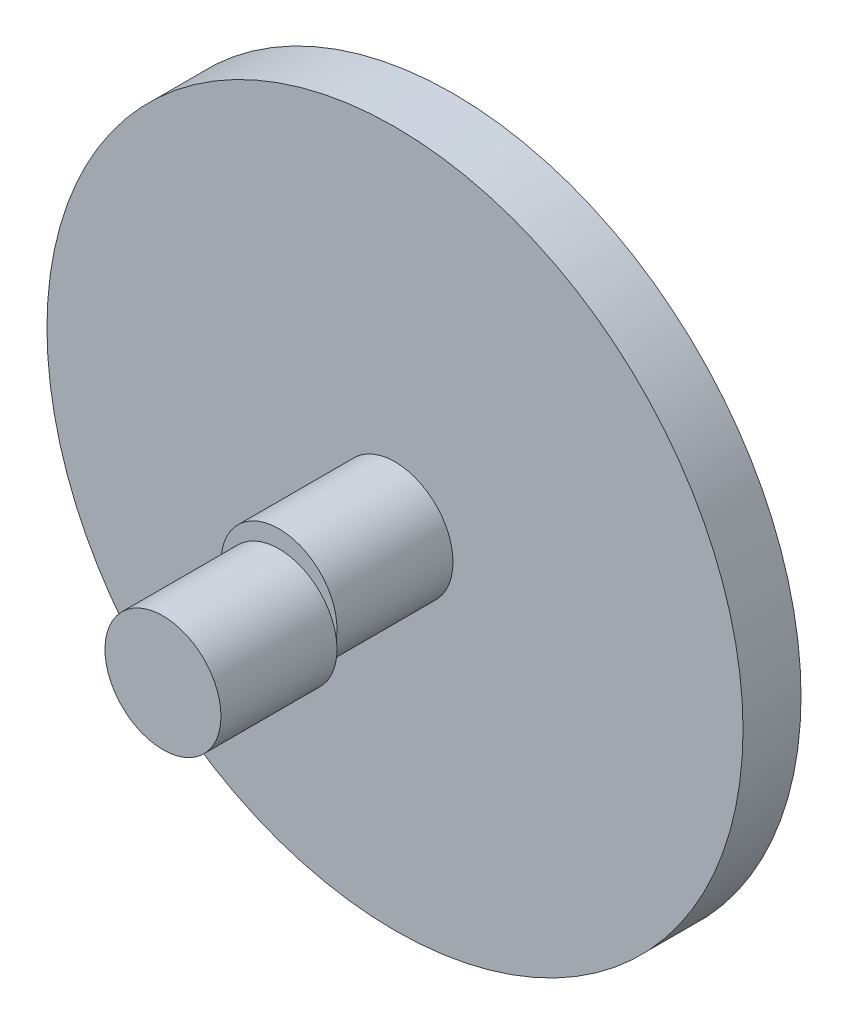
from build123d import *

# Parameters (mm, degrees)
SKETCH1_R           = 38.1
BOSS_EXTRUDE1_DEPTH = 6.35
SKETCH2_R           = 6.35
BOSS_EXTRUDE2_DEPTH = 12.7
SKETCH3_R           = 6.35
BOSS_EXTRUDE3_DEPTH = 12.7
SKETCH4_R           = 3.175
CUT_EXTRUDE1_DEPTH  = 3.175


with BuildPart() as part:
    # Sketch1 → Boss-Extrude1 (new body)
    with BuildSketch(Plane.XY):
        Circle(SKETCH1_R)
    extrude(amount=BOSS_EXTRUDE1_DEPTH)

    # Sketch2 → Boss-Extrude2 (add)
    with BuildSketch(Plane.XY.offset(6.35)):
        Circle(SKETCH2_R)
    extrude(amount=BOSS_EXTRUDE2_DEPTH)

    # Sketch3 → Boss-Extrude3 (add)
    with BuildSketch(Plane.XY.offset(19.05)):
        with Locations(Location((0, -1.905, 0), (0, 0, 171.373073441))):
            Circle(SKETCH3_R)
    extrude(amount=BOSS_EXTRUDE3_DEPTH)

    # Sketch4 → Cut-Extrude1 (cut)
    with BuildSketch(Plane(origin=(0, 0, 0), x_dir=(-1, 0, 0), z_dir=(0, 0, -1))):
        with Locations((-25.4, 0)):
            Circle(SKETCH4_R)
        with Locations((-12.7, 21.997045256)):
            Circle(SKETCH4_R)
        with Locations((12.7, 21.997045256)):
            Circle(SKETCH4_R)
        with Locations((25.4, 0)):
            Circle(SKETCH4_R)
        with Locations((12.7, -21.997045256)):
            Circle(SKETCH4_R)
        with Locations((-12.7, -21.997045256)):
            Circle(SKETCH4_R)
    extrude(amount=-CUT_EXTRUDE1_DEPTH, mode=Mode.SUBTRACT)


solid = part.part
